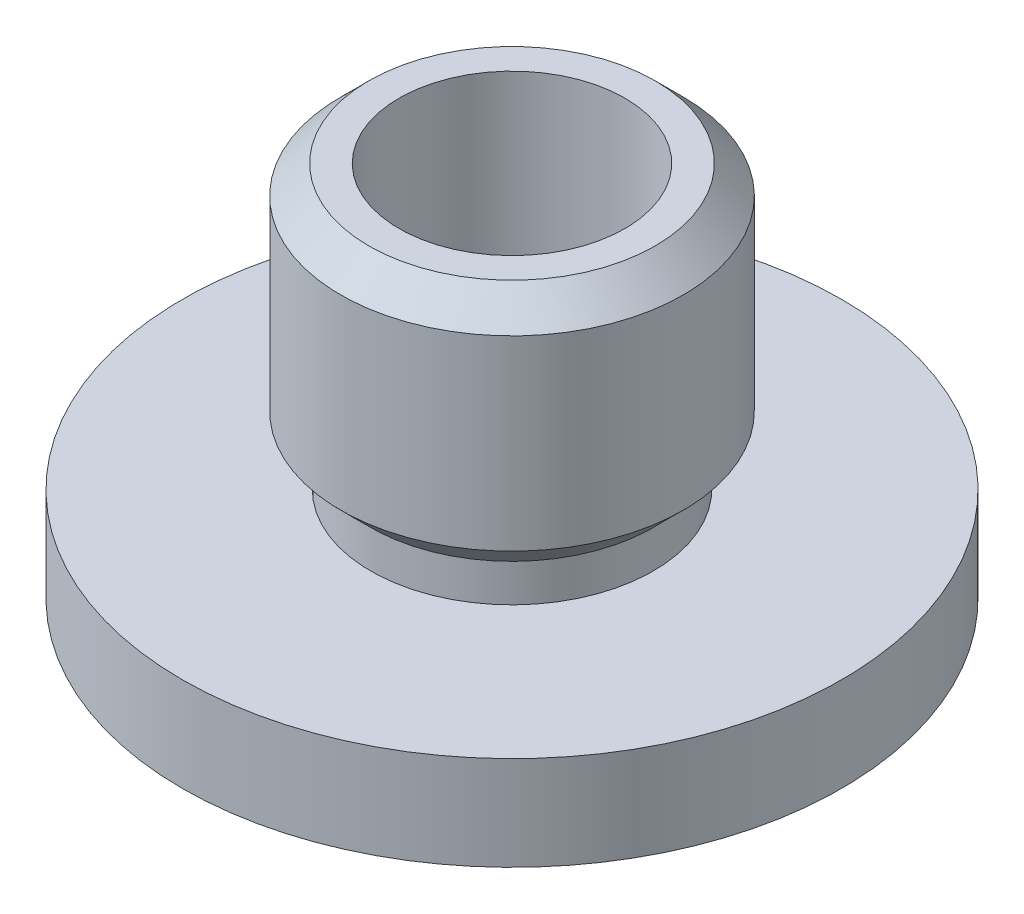
from build123d import *


with BuildPart() as part:
    # Sketch1 → Revolve1 (revolve)
    with BuildSketch(Plane.XY, mode=Mode.PRIVATE) as revolve1_sk:
        Polygon((6, 0), (7.6, 0), (9.1, -1.5), (9.1, -11.4), (7.5, -13), (7.5, -15), (17.5, -15), (17.5, -20), (6, -20), align=None)
    revolve(revolve1_sk.sketch.rotate(Axis((0, -65.959732646, 0), (0, 1, 0)), 90), axis=Axis((0, -65.959732646, 0), (0, 1, 0)))


solid = part.part
